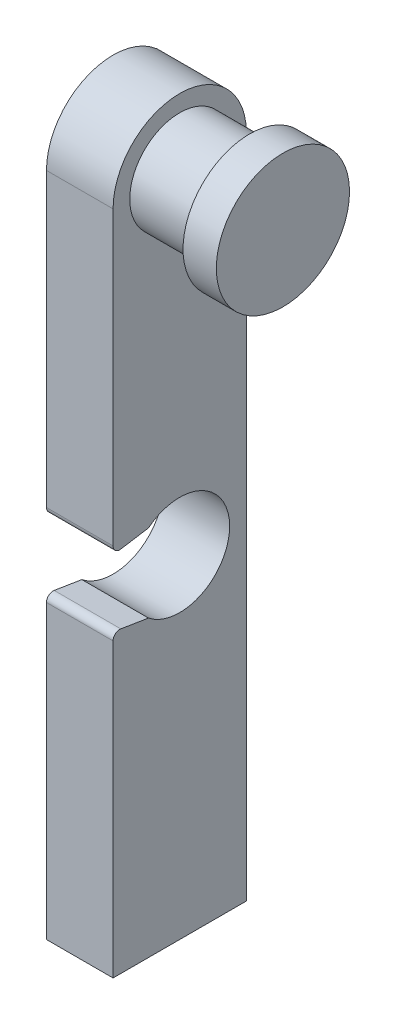
from build123d import *

# Parameters (mm, degrees)
BASE_DEPTH         = 2
ESQUISSE2_R        = 1.5
BOSS_FIX_DEPTH     = 2.1
ESQUISSE3_R        = 2
BOSS_BLOCAGE_DEPTH = 1
VIDE_TIGE_DEPTH    = 2
CONGE_TIGE_R       = 0.2


with BuildPart() as part:
    # Esquisse1 → BASE (new body)
    with BuildSketch(Plane(origin=(0, 0, 0), x_dir=(0, 0, -1), z_dir=(1, 0, 0))):
        with BuildLine():
            Line((2, 10), (2, -10))
            Line((2, -10), (-2, -10))
            Line((-2, -10), (-2, 10))
            ThreePointArc((-2, 10), (0, 12), (2, 10))
        make_face()
    extrude(amount=BASE_DEPTH)

    # Esquisse2 → BOSS FIX (add)
    with BuildSketch(Plane(origin=(2, 0, 0), x_dir=(0, 0, -1), z_dir=(1, 0, 0))):
        with Locations((0, 10)):
            Circle(ESQUISSE2_R)
    extrude(amount=BOSS_FIX_DEPTH)

    # Esquisse3 → BOSS BLOCAGE (add)
    with BuildSketch(Plane(origin=(4.1, 0, 0), x_dir=(0, 0, -1), z_dir=(1, 0, 0))):
        with Locations((0, 10)):
            Circle(ESQUISSE3_R)
    extrude(amount=BOSS_BLOCAGE_DEPTH)

    # Esquisse4 → VIDE TIGE (cut)
    with BuildSketch(Plane.ZY):
        with BuildLine():
            Line((2, 1), (0.937042571, 1.171303214))
            ThreePointArc((0.937042571, 1.171303214), (-1.5, 0), (0.937042571, -1.171303214))
            Line((0.937042571, -1.171303214), (2, -1))
            Line((2, -1), (2, 1))
        make_face()
    extrude(amount=-VIDE_TIGE_DEPTH, mode=Mode.SUBTRACT)

    # CONGE TIGE
    conge_tige_edges = [part.edges().sort_by_distance(p)[0] for p in [
        (1, -1, 2),
        (1, 1, 2),
    ]]
    fillet(conge_tige_edges, radius=CONGE_TIGE_R)


solid = part.part
